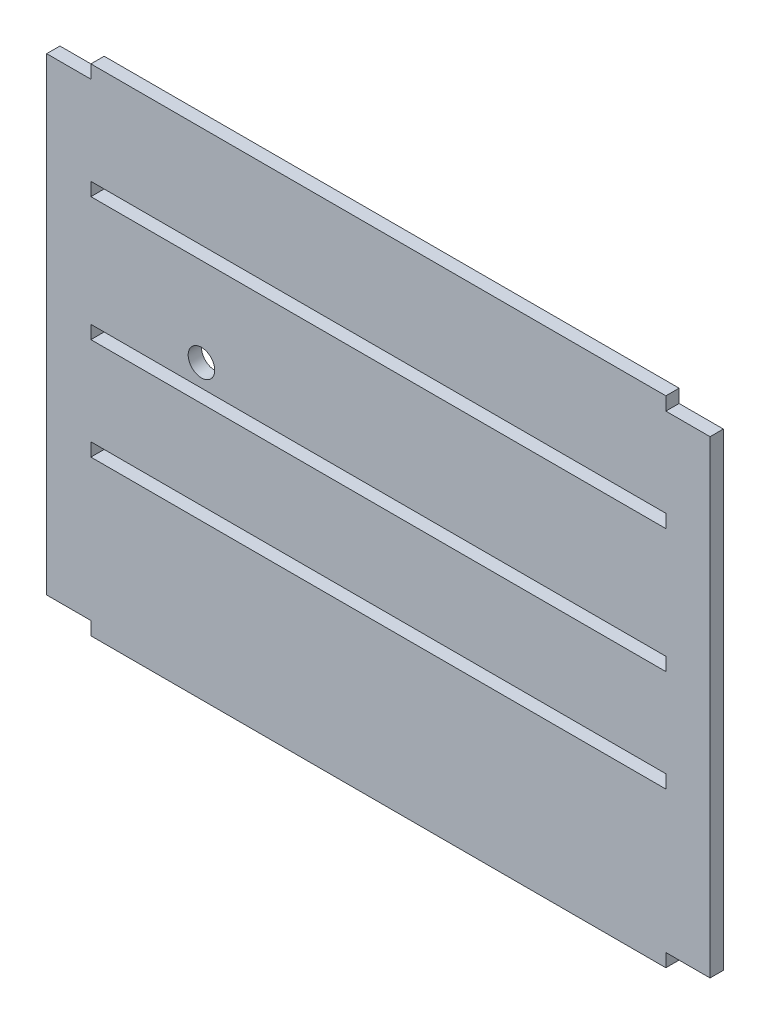
from build123d import *

# Parameters (mm, degrees)
SKETCH1_W           = 130
SKETCH1_H           = 3
SKETCH1_R           = 3
BOSS_EXTRUDE1_DEPTH = 3


with BuildPart() as part:
    # Sketch1 → Boss-Extrude1 (new body)
    with BuildSketch(Plane.XY):
        Polygon((70.303030303, 34.481481481), (-59.696969697, 34.481481481), (-59.696969697, 31.481481481), (-69.696969697, 31.481481481), (-69.696969697, -74.518518519), (-59.696969697, -74.518518519), (-59.696969697, -77.518518519), (70.303030303, -77.518518519), (70.303030303, -74.518518519), (80.303030303, -74.518518519), (80.303030303, 31.481481481), (70.303030303, 31.481481481), align=None)
        with Locations((5.303030303, -41.018518519)):
            Rectangle(SKETCH1_W, SKETCH1_H, mode=Mode.SUBTRACT)
        with Locations((-34.696969697, -11.518518519)):
            Circle(SKETCH1_R, mode=Mode.SUBTRACT)
        with Locations((5.303030303, -18.018518519)):
            Rectangle(SKETCH1_W, SKETCH1_H, mode=Mode.SUBTRACT)
        with Locations((5.303030303, 9.981481481)):
            Rectangle(SKETCH1_W, SKETCH1_H, mode=Mode.SUBTRACT)
    extrude(amount=BOSS_EXTRUDE1_DEPTH)


solid = part.part
